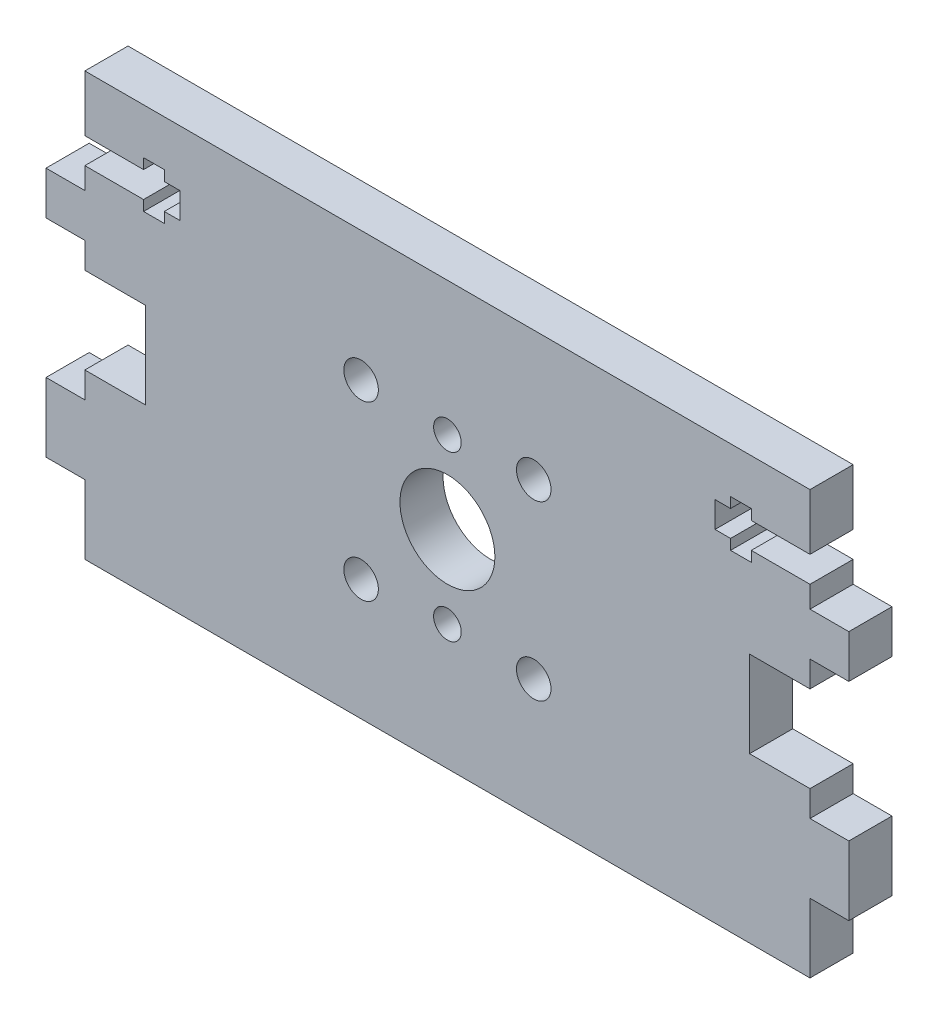
from build123d import *

# Parameters (mm, degrees)
MODEL_R                  = 1.6
MODEL_R_2                = 2
MODEL_R_3                = 5.5
RESSALTO_EXTRUS_O1_DEPTH = 5


with BuildPart() as part:
    # Model → Ressalto-extrusão1 (new body)
    with BuildSketch(Plane.XY):
        Polygon((-6.199999159, 114.700001655), (-6.199999159, 113.500001714), (-7.999999159, 113.500001714), (-7.999999159, 110.500001669), (-6.199999159, 110.500001669), (-6.199999159, 109.300001727), (-3.799999815, 109.300001727), (-3.799999815, 110.500001669), (3.000000179, 110.500001669), (3.000000179, 108.000001654), (7.500000924, 108.000001654), (7.500000924, 103.000001535), (3.000000179, 103.000001535), (3.000000179, 100.00000149), (-3.999999195, 100.00000149), (-3.999999195, 90.000001341), (3.000000179, 90.000001341), (3.000000179, 87.000001296), (7.500000924, 87.000001296), (7.500000924, 79.000001177), (3.000000179, 79.000001177), (3.000000179, 71.000001058), (-80.999999166, 71.000001058), (-80.999999166, 79.000001177), (-85.499999911, 79.000001177), (-85.499999911, 87.000001296), (-80.999999166, 87.000001296), (-80.999999166, 90.000001341), (-73.999999791, 90.000001341), (-73.999999791, 100.00000149), (-80.999999166, 100.00000149), (-80.999999166, 103.000001535), (-85.499999911, 103.000001535), (-85.499999911, 108.000001654), (-80.999999166, 108.000001654), (-80.999999166, 110.500001669), (-74.199999172, 110.500001669), (-74.199999172, 109.300001727), (-71.799999827, 109.300001727), (-71.799999827, 110.500001669), (-69.999999827, 110.500001669), (-69.999999827, 113.500001714), (-71.799999827, 113.500001714), (-71.799999827, 114.700001655), (-74.199999172, 114.700001655), (-74.199999172, 113.500001714), (-80.999999166, 113.500001714), (-80.999999166, 120.000001773), (3.000000179, 120.000001773), (3.000000179, 113.500001714), (-3.799999815, 113.500001714), (-3.799999815, 114.700001655), align=None)
        with Locations((-38.999999449, 85.500001416)):
            Circle(MODEL_R, mode=Mode.SUBTRACT)
        with Locations((-29.000000507, 105.000001535)):
            Circle(MODEL_R_2, mode=Mode.SUBTRACT)
        with Locations((-38.999999449, 104.500001416)):
            Circle(MODEL_R, mode=Mode.SUBTRACT)
        with Locations((-49.000000507, 85.000001296)):
            Circle(MODEL_R_2, mode=Mode.SUBTRACT)
        with Locations((-49.000000507, 105.000001535)):
            Circle(MODEL_R_2, mode=Mode.SUBTRACT)
        with Locations((-38.999999493, 95.000001416)):
            Circle(MODEL_R_3, mode=Mode.SUBTRACT)
        with Locations((-29.000000507, 85.000001296)):
            Circle(MODEL_R_2, mode=Mode.SUBTRACT)
    extrude(amount=RESSALTO_EXTRUS_O1_DEPTH)


solid = part.part
